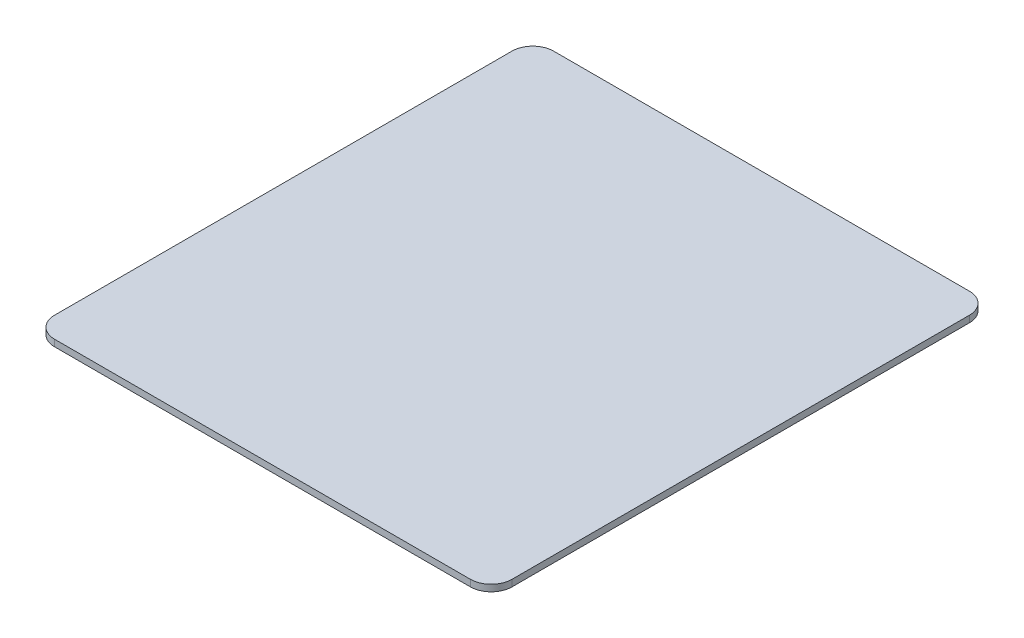
from build123d import *

# Parameters (mm, degrees)
BOSS_EXTRUDE1_DEPTH = 3.175


with BuildPart() as part:
    # Sketch1 → Boss-Extrude1 (new body)
    with BuildSketch(Plane(origin=(0, 0, 0), x_dir=(1, 0, 0), z_dir=(0, 1, 0))):
        with BuildLine():
            Line((10, 0), (210, 0))
            ThreePointArc((210, 0), (217.071067812, 2.928932188), (220, 10))
            Line((220, 10), (220, 230))
            ThreePointArc((220, 230), (217.071067812, 237.071067812), (210, 240))
            Line((210, 240), (10, 240))
            ThreePointArc((10, 240), (2.928932188, 237.071067812), (0, 230))
            Line((0, 230), (0, 10))
            ThreePointArc((0, 10), (2.928932188, 2.928932188), (10, 0))
        make_face()
    extrude(amount=BOSS_EXTRUDE1_DEPTH)


solid = part.part
